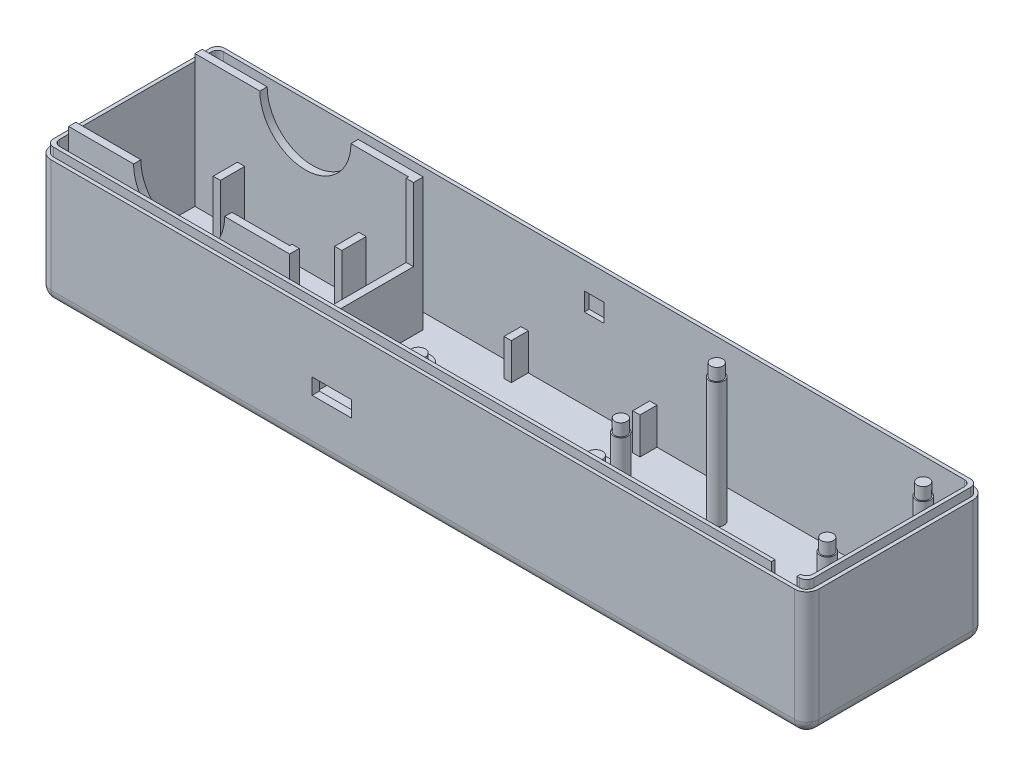
from build123d import *

# Parameters (mm, degrees)
SKETCH1_W            = 160.5788
SKETCH1_H            = 37.338
BOSS_EXTRUDE1_DEPTH  = 27.94
SKETCH2_W            = 157.5308
SKETCH2_H            = 34.29
CUT_EXTRUDE3_DEPTH   = 26.289
FILLET1_R            = 2.54
FILLET2_R            = 1.27
SKETCH3_W            = 46.228
SKETCH3_H            = 27.94
BOSS_EXTRUDE2_DEPTH  = 27.686
SKETCH8_W            = 44.704
SKETCH8_H            = 24.892
CUT_EXTRUDE6_DEPTH   = 27.686
CUT_EXTRUDE5_REACH   = 93.501
SKETCH7_R            = 9.525
CUT_EXTRUDE7_REACH   = 121.521
SKETCH9_W            = 23.876
SKETCH9_H            = 15.24
SKETCH10_R           = 2.54
SKETCH10_W           = 1.524
SKETCH10_H           = 3.556
BOSS_EXTRUDE5_DEPTH  = 7.62
SKETCH11_R           = 1.4605
BOSS_EXTRUDE6_DEPTH  = 1.651
CUT_EXTRUDE8_REACH   = 95.28
SKETCH12_W           = 8.218436834
SKETCH12_H           = 3.333271446
SKETCH13_R           = 1.524
BOSS_EXTRUDE7_DEPTH  = 26.162
SKETCH14_R           = 1.27
BOSS_EXTRUDE8_DEPTH  = 2.54
SKETCH15_W           = 1.524
SKETCH15_H           = 5.08
BOSS_EXTRUDE9_DEPTH  = 12.446
SKETCH16_OUTSIDE_W   = 196.104
SKETCH16_OUTSIDE_H   = 72.864
SKETCH16_OUTSIDE_W_2 = 159.0548
SKETCH16_OUTSIDE_H_2 = 35.814
CUT_EXTRUDE9_DEPTH   = 1.778
FILLET3_R            = 1.524
SKETCH17_W           = 5.334
SKETCH17_H           = 0.762
CUT_EXTRUDE10_DEPTH  = 8.89
SKETCH18_W           = 4.064
SKETCH18_H           = 3.81
CUT_EXTRUDE11_DEPTH  = 1.016


with BuildPart() as part:
    # Sketch1 → Boss-Extrude1 (new body)
    with BuildSketch(Plane(origin=(0, 0, 0), x_dir=(1, 0, 0), z_dir=(0, 1, 0))):
        Rectangle(SKETCH1_W, SKETCH1_H)
    extrude(amount=BOSS_EXTRUDE1_DEPTH)

    # Sketch2 → Cut-Extrude3 (cut)
    with BuildSketch(Plane(origin=(0, 27.94, 0), x_dir=(1, 0, 0), z_dir=(0, 1, 0))):
        Rectangle(SKETCH2_W, SKETCH2_H)
    extrude(amount=-CUT_EXTRUDE3_DEPTH, mode=Mode.SUBTRACT)

    # Fillet1
    fillet1_edges = [part.edges().sort_by_distance(p)[0] for p in [
        (0, 0, 18.669),
        (-80.2894, 0, 0),
        (0, 0, -18.669),
        (80.2894, 0, 0),
        (80.2894, 13.97, 18.669),
        (-80.2894, 13.97, 18.669),
        (-80.2894, 13.97, -18.669),
        (80.2894, 13.97, -18.669),
    ]]
    fillet(fillet1_edges, radius=FILLET1_R)

    # Fillet2
    fillet2_edges = [part.edges().sort_by_distance(p)[0] for p in [
        (-78.7654, 14.7955, -17.145),
        (-78.7654, 14.7955, 17.145),
        (78.7654, 14.7955, 17.145),
        (78.7654, 14.7955, -17.145),
    ]]
    fillet(fillet2_edges, radius=FILLET2_R)

    # Sketch3 → Boss-Extrude2 (add)
    with BuildSketch(Plane(origin=(0, 1.651, 0), x_dir=(1, 0, 0), z_dir=(0, 1, 0))):
        with Locations((-55.6514, 0)):
            Rectangle(SKETCH3_W, SKETCH3_H)
    extrude(amount=BOSS_EXTRUDE2_DEPTH)

    # Sketch8 → Cut-Extrude6 (cut)
    with BuildSketch(Plane(origin=(0, 29.337, 0), x_dir=(1, 0, 0), z_dir=(0, 1, 0))):
        with Locations((-56.4134, 0)):
            Rectangle(SKETCH8_W, SKETCH8_H)
    extrude(amount=-CUT_EXTRUDE6_DEPTH, mode=Mode.SUBTRACT)

    # Cut-Extrude5: up to this face of the body (flat: up to its plane)
    cut_extrude5_end = Plane(part.part.faces().sort_by_distance((-55.6514, 15.494, -13.97))[0])
    # Sketch7 → Cut-Extrude5 (cut, up to the picked face)
    with BuildSketch(Plane.XY.offset(13.97), mode=Mode.PRIVATE) as cut_extrude5_sk1:
        with Locations((-55.6514, 29.337)):
            Circle(SKETCH7_R)
    cut_extrude5_tool1 = split(extrude(cut_extrude5_sk1.sketch, amount=-CUT_EXTRUDE5_REACH, mode=Mode.PRIVATE), bisect_by=cut_extrude5_end, keep=Keep.BOTH, mode=Mode.PRIVATE)
    add(cut_extrude5_tool1.solids().sort_by(Axis((-55.6514, 29.337, 13.97), (0, 0, -1)))[0], mode=Mode.SUBTRACT)

    # Sketch9 → Cut-Extrude7 (cut, up to next)
    with BuildSketch(Plane.ZY.offset(34.0614), mode=Mode.PRIVATE) as cut_extrude7_sk1:
        with Locations((0, 21.717)):
            Rectangle(SKETCH9_W, SKETCH9_H)
    cut_extrude7_tool1 = extrude(cut_extrude7_sk1.sketch, amount=-CUT_EXTRUDE7_REACH, mode=Mode.PRIVATE) & part.part
    add(cut_extrude7_tool1.solids().sort_by_distance((-34.0614, 21.717, 0))[0], mode=Mode.SUBTRACT)

    # Sketch10 → Boss-Extrude5 (add)
    with BuildSketch(Plane(origin=(0, 1.651, 0), x_dir=(1, 0, 0), z_dir=(0, 1, 0))):
        with Locations(Location((-19.5834, 0, 0), (0, 0, 90))):
            Circle(SKETCH10_R)
        with Locations(Location((17.5006, 0, 0), (0, 0, 90))):
            Circle(SKETCH10_R)
        with Locations((-14.5034, 15.367)):
            Rectangle(SKETCH10_W, SKETCH10_H)
        with Locations((12.4206, 15.367)):
            Rectangle(SKETCH10_W, SKETCH10_H)
        with Locations((-14.5034, -15.367)):
            Rectangle(SKETCH10_W, SKETCH10_H)
        with Locations((12.4206, -15.367)):
            Rectangle(SKETCH10_W, SKETCH10_H)
    extrude(amount=BOSS_EXTRUDE5_DEPTH)

    # Sketch11 → Boss-Extrude6 (add)
    with BuildSketch(Plane(origin=(0, 9.271, 0), x_dir=(1, 0, 0), z_dir=(0, 1, 0))):
        with Locations(Location((17.5006, 0, 0), (0, 0, 90))):
            Circle(SKETCH11_R)
        with Locations(Location((-19.5834, 0, 0), (0, 0, 90))):
            Circle(SKETCH11_R)
    extrude(amount=BOSS_EXTRUDE6_DEPTH)

    # Sketch12 → Cut-Extrude8 (cut, up to next)
    with BuildSketch(Plane.XY.offset(18.669), mode=Mode.PRIVATE) as cut_extrude8_sk1:
        with Locations((-19.030181583, 12.461635723)):
            Rectangle(SKETCH12_W, SKETCH12_H)
    cut_extrude8_tool1 = extrude(cut_extrude8_sk1.sketch, amount=-CUT_EXTRUDE8_REACH, mode=Mode.PRIVATE) & part.part
    add(cut_extrude8_tool1.solids().sort_by_distance((-19.030182, 12.461636, 18.669))[0], mode=Mode.SUBTRACT)

    # Sketch13 → Boss-Extrude7 (add)
    with BuildSketch(Plane(origin=(0, 1.651, 0), x_dir=(1, 0, 0), z_dir=(0, 1, 0))):
        with Locations(Location((32.7914, 10.033, 0), (0, 0, 90))):
            Circle(SKETCH13_R)
        with Locations(Location((75.9714, 10.033, 0), (0, 0, 90))):
            Circle(SKETCH13_R)
        with Locations(Location((75.9714, -10.033, 0), (0, 0, 90))):
            Circle(SKETCH13_R)
        with Locations(Location((32.7914, -10.033, 0), (0, 0, 90))):
            Circle(SKETCH13_R)
    extrude(amount=BOSS_EXTRUDE7_DEPTH)

    # Sketch14 → Boss-Extrude8 (add)
    with BuildSketch(Plane(origin=(0, 27.813, 0), x_dir=(1, 0, 0), z_dir=(0, 1, 0))):
        with Locations(Location((32.7914, 10.033, 0), (0, 0, 270))):
            Circle(SKETCH14_R)
        with Locations(Location((32.7914, -10.033, 0), (0, 0, 270))):
            Circle(SKETCH14_R)
        with Locations(Location((75.9714, -10.033, 0), (0, 0, 270))):
            Circle(SKETCH14_R)
        with Locations(Location((75.9714, 10.033, 0), (0, 0, 270))):
            Circle(SKETCH14_R)
    extrude(amount=BOSS_EXTRUDE8_DEPTH)

    # Sketch15 → Boss-Extrude9 (add)
    with BuildSketch(Plane(origin=(0, 1.651, 0), x_dir=(1, 0, 0), z_dir=(0, 1, 0))):
        with Locations((-43.7134, 9.906)):
            Rectangle(SKETCH15_W, SKETCH15_H)
        with Locations((-43.7134, -9.906)):
            Rectangle(SKETCH15_W, SKETCH15_H)
        with Locations((-69.1134, 9.906)):
            Rectangle(SKETCH15_W, SKETCH15_H)
        with Locations((-69.1134, -9.906)):
            Rectangle(SKETCH15_W, SKETCH15_H)
    extrude(amount=BOSS_EXTRUDE9_DEPTH)

    # Sketch16 outside → Cut-Extrude9 (cut)
    with BuildSketch(Plane(origin=(0, 27.94, 0), x_dir=(1, 0, 0), z_dir=(0, 1, 0))):
        Rectangle(SKETCH16_OUTSIDE_W, SKETCH16_OUTSIDE_H)
        Rectangle(SKETCH16_OUTSIDE_W_2, SKETCH16_OUTSIDE_H_2, mode=Mode.SUBTRACT)
    extrude(amount=-CUT_EXTRUDE9_DEPTH, mode=Mode.SUBTRACT)

    # Fillet3
    fillet3_edges = [part.edges().sort_by_distance(p)[0] for p in [
        (-79.5274, 27.051, -17.907),
        (79.5274, 27.051, -17.907),
        (79.5274, 27.051, 17.907),
        (-79.5274, 27.051, 17.907),
    ]]
    fillet(fillet3_edges, radius=FILLET3_R)

    # Sketch17 → Cut-Extrude10 (cut)
    with BuildSketch(Plane(origin=(0, 27.94, 0), x_dir=(1, 0, 0), z_dir=(0, 1, 0))):
        with Locations((74.8284, -17.526)):
            Rectangle(SKETCH17_W, SKETCH17_H)
    extrude(amount=-CUT_EXTRUDE10_DEPTH, mode=Mode.SUBTRACT)

    # Sketch18 → Cut-Extrude11 (cut)
    with BuildSketch(Plane(origin=(0, 0, 17.145), x_dir=(-1, 0, 0), z_dir=(0, 0, -1))):
        with Locations((-0.0254, 20.447)):
            Rectangle(SKETCH18_W, SKETCH18_H)
    cut_extrude11 = extrude(amount=-CUT_EXTRUDE11_DEPTH, mode=Mode.SUBTRACT)

    # Mirror1: Cut-Extrude11 across plane
    add(cut_extrude11.mirror(Plane.XY), mode=Mode.SUBTRACT)


solid = part.part
